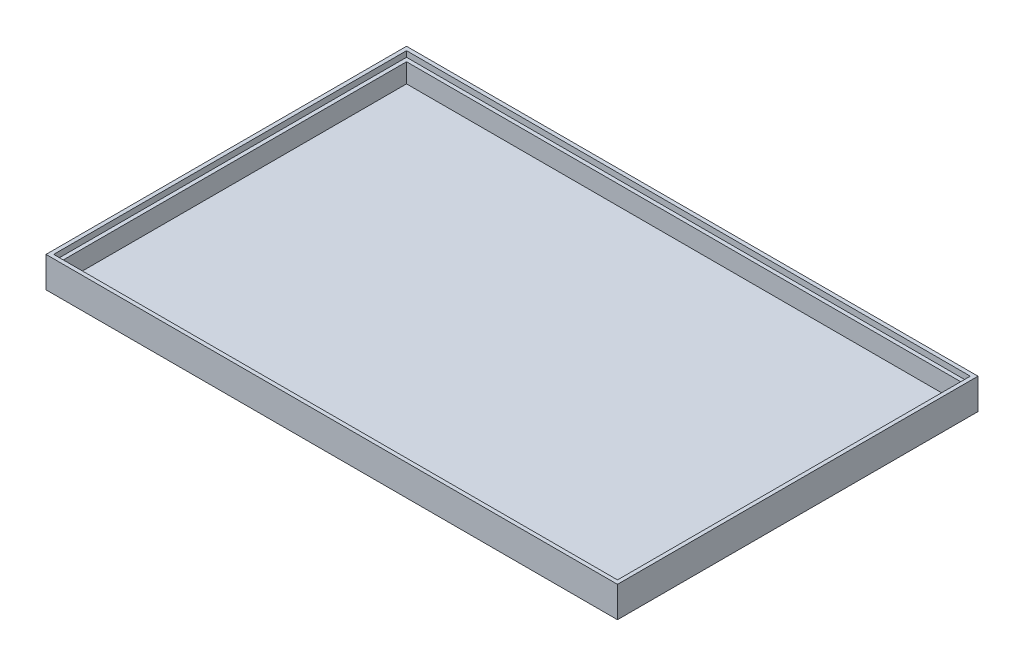
from build123d import *

# Parameters (mm, degrees)
SKETCH1_W           = 145
SKETCH1_H           = 90
BOSS_EXTRUDE1_DEPTH = 1.5
SKETCH2_W           = 149
SKETCH2_H           = 94
SKETCH2_W_2         = 145
SKETCH2_H_2         = 90
BOSS_EXTRUDE2_DEPTH = 8
SKETCH3_W           = 147
SKETCH3_H           = 92
SKETCH3_W_2         = 145
SKETCH3_H_2         = 90
CUT_EXTRUDE1_DEPTH  = 1.5


with BuildPart() as part:
    # Sketch1 → Boss-Extrude1 (new body)
    with BuildSketch(Plane(origin=(0, 0, 0), x_dir=(1, 0, 0), z_dir=(0, 1, 0))):
        Rectangle(SKETCH1_W, SKETCH1_H)
    extrude(amount=BOSS_EXTRUDE1_DEPTH)

    # Sketch2 → Boss-Extrude2 (add)
    with BuildSketch(Plane(origin=(0, 0, 0), x_dir=(1, 0, 0), z_dir=(0, 1, 0))):
        Rectangle(SKETCH2_W, SKETCH2_H)
        Rectangle(SKETCH2_W_2, SKETCH2_H_2, mode=Mode.SUBTRACT)
    extrude(amount=BOSS_EXTRUDE2_DEPTH)

    # Sketch3 → Cut-Extrude1 (cut)
    with BuildSketch(Plane(origin=(0, 8, 0), x_dir=(1, 0, 0), z_dir=(0, 1, 0))):
        Rectangle(SKETCH3_W, SKETCH3_H)
        Rectangle(SKETCH3_W_2, SKETCH3_H_2, mode=Mode.SUBTRACT)
    extrude(amount=-CUT_EXTRUDE1_DEPTH, mode=Mode.SUBTRACT)


solid = part.part
